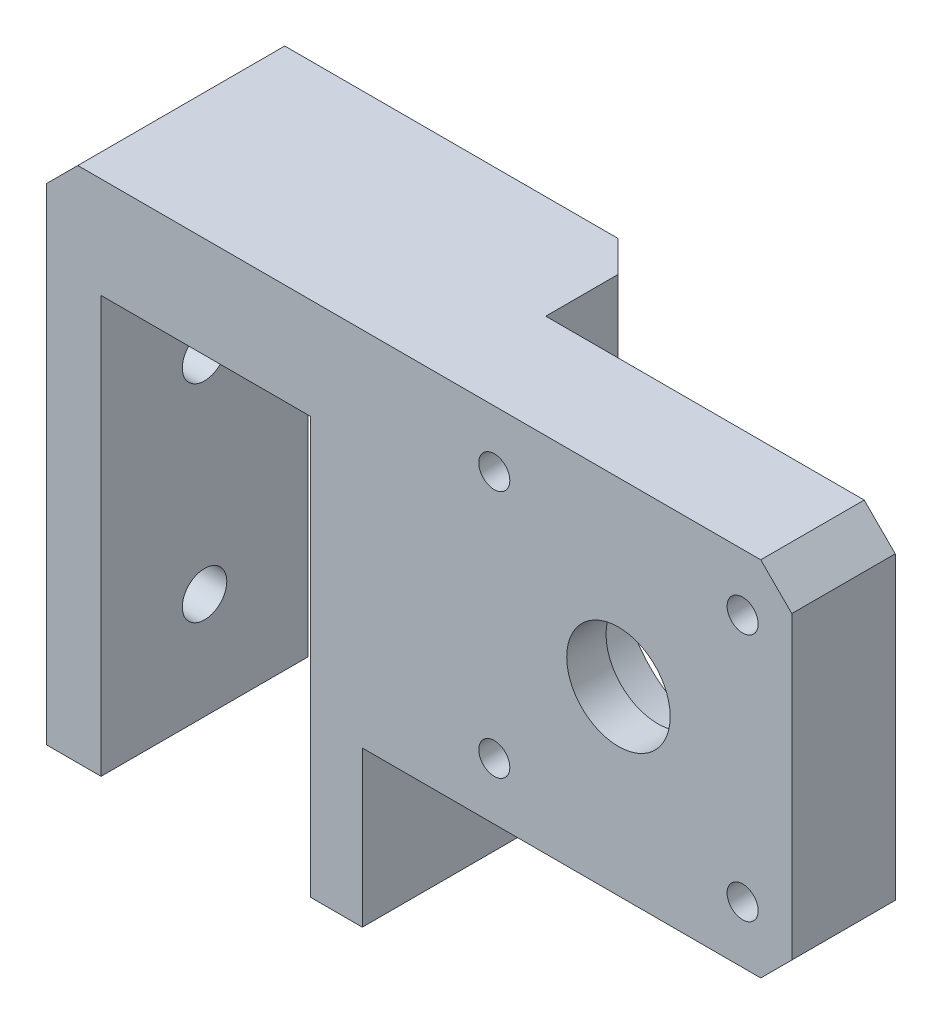
from build123d import *

# Parameters (mm, degrees)
SKETCH_5_R          = 5
SKETCH_5_R_2        = 1.5
EXTRUDE_1_DEPTH     = 20
SKETCH_6_R          = 2.15
CUT_EXTRUDE_3_DEPTH = 20
CUT_EXTRUDE_START   = -20
SKETCH_7_R          = 2.15
CUT_EXTRUDE_4_DEPTH = 20
SKETCH_8_W          = 33.77726644
SKETCH_8_H          = 35
CUT_EXTRUDE_5_DEPTH = 10
SKETCH_9_R          = 9.75
CUT_EXTRUDE_6_DEPTH = 6.2
CHAMFER_1_SIZE      = 3
SKETCH_10_W         = 20
SKETCH_10_H         = 40.5
SKETCH_10_R         = 2.15
EXTRUDE_2_DEPTH     = 0.25
SKETCH_11_W         = 20.25
SKETCH_11_H         = 20
EXTRUDE_3_DEPTH     = 0.25


with BuildPart() as part:
    # 草图5 → 凸台-拉伸1 (new body)
    with BuildSketch(Plane.XY):
        Polygon((0, 0), (0, 50), (72, 50), (72, 15), (30.5, 15), (30.5, 0), (25.5, 0), (25.5, 40.5), (5, 40.5), (5, 0), align=None)
        with Locations((55.25, 32.5)):
            Circle(SKETCH_5_R, mode=Mode.SUBTRACT)
        with Locations((43.25, 44.5)):
            Circle(SKETCH_5_R_2, mode=Mode.SUBTRACT)
        with Locations((67.25, 44.5)):
            Circle(SKETCH_5_R_2, mode=Mode.SUBTRACT)
        with Locations((43.25, 20.5)):
            Circle(SKETCH_5_R_2, mode=Mode.SUBTRACT)
        with Locations((67.25, 20.5)):
            Circle(SKETCH_5_R_2, mode=Mode.SUBTRACT)
    extrude(amount=EXTRUDE_1_DEPTH)

    # 草图6 → 切除-拉伸3 (cut)
    with BuildSketch(Plane.ZY):
        with Locations((10, 10.25)):
            Circle(SKETCH_6_R)
        with Locations((10, 30.25)):
            Circle(SKETCH_6_R)
    extrude(amount=-CUT_EXTRUDE_3_DEPTH, mode=Mode.SUBTRACT)

    # 草图7 → 切除-拉伸4 (cut)
    with BuildSketch(Plane(origin=(30.5, 0, 0), x_dir=(0, 0, -1), z_dir=(1, 0, 0)).offset(CUT_EXTRUDE_START)):
        with Locations(Location((-10, 10.25, 0), (0, 0, 180))):
            Circle(SKETCH_7_R)
    extrude(amount=CUT_EXTRUDE_4_DEPTH, mode=Mode.SUBTRACT)

    # 草图8 → 切除-拉伸5 (cut)
    with BuildSketch(Plane(origin=(0, 0, 0), x_dir=(-1, 0, 0), z_dir=(0, 0, -1))):
        with Locations((-55.11136678, 32.5)):
            Rectangle(SKETCH_8_W, SKETCH_8_H)
    extrude(amount=-CUT_EXTRUDE_5_DEPTH, mode=Mode.SUBTRACT)

    # 草图9 → 切除-拉伸6 (cut)
    with BuildSketch(Plane(origin=(0, 0, 10), x_dir=(-1, 0, 0), z_dir=(0, 0, -1))):
        with Locations((-55.25, 32.5)):
            Circle(SKETCH_9_R)
    extrude(amount=-CUT_EXTRUDE_6_DEPTH, mode=Mode.SUBTRACT)

    # 倒角1
    chamfer_1_edges = [part.edges().sort_by_distance(p)[0] for p in [
        (0, 50, 10),
        (72, 50, 15),
        (72, 15, 15),
        (38.22273356, 32.5, 0),
    ]]
    chamfer(chamfer_1_edges, length=CHAMFER_1_SIZE)

    # 草图10 → 凸台-拉伸2 (add)
    with BuildSketch(Plane(origin=(5, 0, 0), x_dir=(0, 0, -1), z_dir=(1, 0, 0))):
        with Locations((-10, 20.25)):
            Rectangle(SKETCH_10_W, SKETCH_10_H)
        with Locations(Location((-10, 10.25, 0), (0, 0, 180))):
            Circle(SKETCH_10_R, mode=Mode.SUBTRACT)
        with Locations(Location((-10, 30.25, 0), (0, 0, 180))):
            Circle(SKETCH_10_R, mode=Mode.SUBTRACT)
    extrude(amount=EXTRUDE_2_DEPTH)

    # 草图11 → 凸台-拉伸3 (add)
    with BuildSketch(Plane.XZ.offset(-40.5)):
        with Locations((15.375, 10)):
            Rectangle(SKETCH_11_W, SKETCH_11_H)
    extrude(amount=EXTRUDE_3_DEPTH)


solid = part.part
